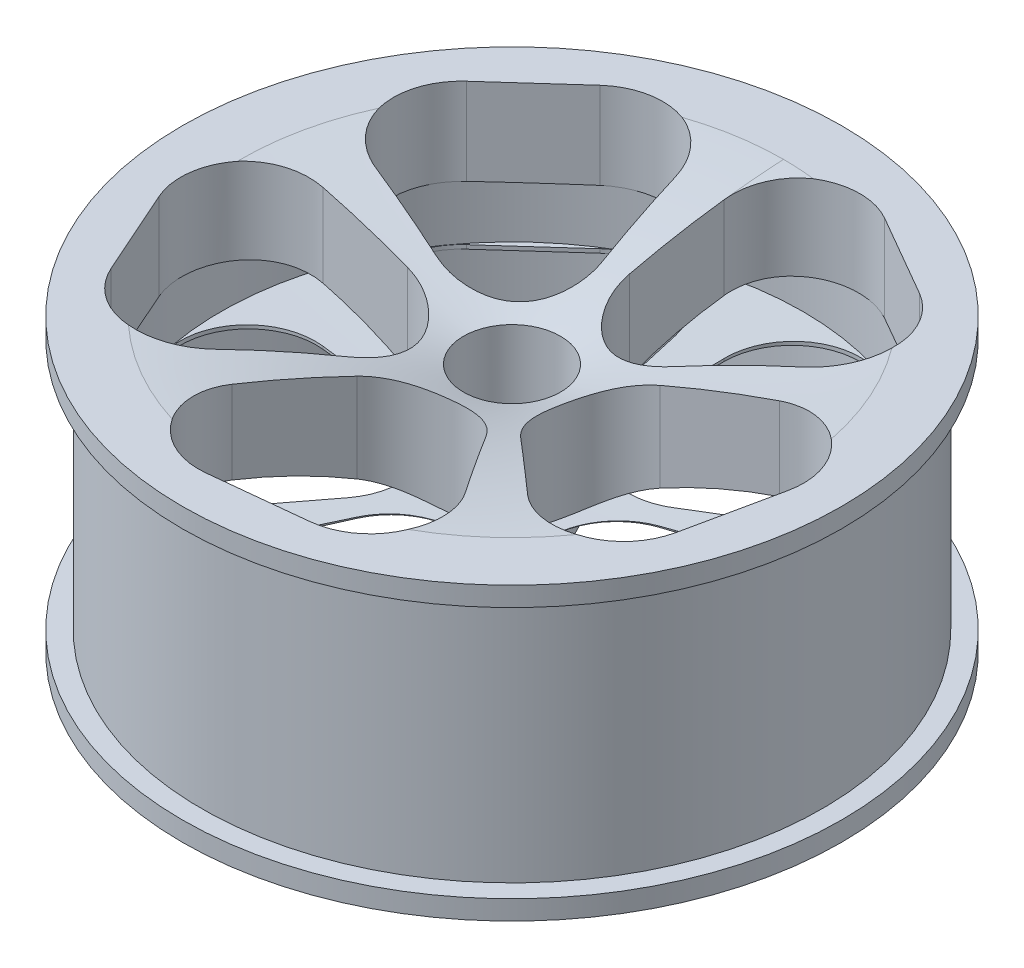
from build123d import *

# Parameters (mm, degrees)
SKETCH1_R           = 50
BOSS_EXTRUDE1_DEPTH = 30
SKETCH3_R           = 340
SKETCH3_R_2         = 50
BOSS_EXTRUDE2_DEPTH = 150
SKETCH5_W           = 20
SKETCH5_H           = 130


with BuildPart() as part:
    # Sketch1 → Boss-Extrude1 (new body)
    with BuildSketch(Plane(origin=(0, 0, 0), x_dir=(1, 0, 0), z_dir=(0, 1, 0))):
        with Locations(Location((0, 0, 0), (0, 0, 270))):
            Circle(SKETCH1_R)
    extrude(amount=BOSS_EXTRUDE1_DEPTH)


with BuildPart() as body_2:
    # Sketch2 → Revolve2 (revolve)
    with BuildSketch(Plane.XY, mode=Mode.PRIVATE) as revolve2_sk:
        Polygon((-300, -27.720873828), (-300, 180), (-340, 180), (-340, 160), (-320, 160), (-320, -100), (-340, -100), (-340, -120), (-300, -120), align=None)
    revolve(revolve2_sk.sketch.rotate(Axis((0, 0, 0), (0, 1, 0)), 270), axis=Axis((0, 0, 0), (0, 1, 0)))

    # Sketch3 → Boss-Extrude2 (add)
    with BuildSketch(Plane(origin=(0, 30, 0), x_dir=(1, 0, 0), z_dir=(0, 1, 0))):
        with Locations(Location((0, 0, 0), (0, 0, 90))):
            Circle(SKETCH3_R)
        with Locations(Location((0, 0, 0), (0, 0, 270))):
            Circle(SKETCH3_R_2, mode=Mode.SUBTRACT)
        with BuildLine():
            Line((105, 60.621778265), (189.448637287, 109.378221735))
            ThreePointArc((189.448637287, 109.378221735), (224.448637287, 170), (189.448637287, 230.621778265))
            Line((189.448637287, 230.621778265), (105, 279.378221735))
            ThreePointArc((105, 279.378221735), (35, 279.378221735), (0, 218.75644347))
            Line((0, 218.75644347), (0, 121.24355653))
            ThreePointArc((0, 121.24355653), (35, 60.621778265), (105, 60.621778265))
        make_face(mode=Mode.SUBTRACT)
        with BuildLine():
            Line((208.049741044, 67.599458661), (115.309474496, 37.466319426))
            ThreePointArc((115.309474496, 37.466319426), (68.470332051, -14.553818357), (90.101521658, -81.127774498))
            Line((90.101521658, -81.127774498), (162.567719005, -146.376631664))
            ThreePointArc((162.567719005, -146.376631664), (231.038051056, -160.930450021), (277.877193501, -108.910312238))
            Line((277.877193501, -108.910312238), (298.151262701, -13.528315837))
            ThreePointArc((298.151262701, -13.528315837), (276.520073095, 53.045640304), (208.049741044, 67.599458661))
        make_face(mode=Mode.SUBTRACT)
        with BuildLine():
            Line((128.581811316, -176.977680396), (71.265174464, -98.088097691))
            ThreePointArc((71.265174464, -98.088097691), (7.316992429, -69.616532676), (-49.314197178, -110.761500336))
            Line((-49.314197178, -110.761500336), (-88.976261468, -199.843955262))
            ThreePointArc((-88.976261468, -199.843955262), (-81.65926904, -269.460487938), (-17.711087005, -297.932052953))
            Line((-17.711087005, -297.932052953), (79.267614138, -287.739180733))
            ThreePointArc((79.267614138, -287.739180733), (135.898803744, -246.594213072), (128.581811316, -176.977680396))
        make_face(mode=Mode.SUBTRACT)
        with BuildLine():
            Line((-128.581811316, -176.977680396), (-71.265174464, -98.088097691))
            ThreePointArc((-71.265174464, -98.088097691), (-63.948182035, -28.471565015), (-120.579371641, 12.673402645))
            Line((-120.579371641, 12.673402645), (-217.558072784, 22.866274866))
            ThreePointArc((-217.558072784, 22.866274866), (-281.506254819, -5.605290149), (-288.823247248, -75.221822825))
            Line((-288.823247248, -75.221822825), (-249.161182957, -164.304277751))
            ThreePointArc((-249.161182957, -164.304277751), (-192.529993351, -205.449245412), (-128.581811316, -176.977680396))
        make_face(mode=Mode.SUBTRACT)
        with BuildLine():
            Line((-208.049741044, 67.599458661), (-115.309474496, 37.466319426))
            ThreePointArc((-115.309474496, 37.466319426), (-46.839142445, 52.020137783), (-25.207952839, 118.594093924))
            Line((-25.207952839, 118.594093924), (-45.482022039, 213.976090325))
            ThreePointArc((-45.482022039, 213.976090325), (-92.321164484, 265.996228109), (-160.791496536, 251.442409752))
            Line((-160.791496536, 251.442409752), (-233.257693883, 186.193552585))
            ThreePointArc((-233.257693883, 186.193552585), (-254.888883489, 119.619596445), (-208.049741044, 67.599458661))
        make_face(mode=Mode.SUBTRACT)
    extrude(amount=BOSS_EXTRUDE2_DEPTH)

    # Sketch4 → Cut-Revolve1 (revolve, cut)
    with BuildSketch(Plane.XY, mode=Mode.PRIVATE) as cut_revolve1_sk:
        with BuildLine():
            Line((-300, 216.27795399), (-300, 180.885417192))
            ThreePointArc((-300, 180.885417192), (-173.357132809, 167.752599493), (-49.811718455, 136.97245487))
            Line((-49.811718455, 136.97245487), (0, 136.97245487))
            Line((0, 136.97245487), (0, 173.675826363))
            Line((0, 173.675826363), (0, 216.27795399))
            Line((0, 216.27795399), (-300, 216.27795399))
        make_face()
        with BuildLine():
            Line((-300, 83.228232326), (-300, 79.295728237))
            Line((-300, 79.295728237), (-300, 34.071931218))
            Line((-300, 34.071931218), (-49.811718455, 30))
            ThreePointArc((-49.811718455, 30), (-170.062054213, 80.270316304), (-300, 90.437823155))
            Line((-300, 90.437823155), (-300, 83.228232326))
        make_face()
    revolve(cut_revolve1_sk.sketch.rotate(Axis((0, 173.675826363, 0), (0, -1, 0)), 90), axis=Axis((0, 173.675826363, 0), (0, -1, 0)), mode=Mode.SUBTRACT)

    # Sketch5 → Cut-Revolve2 (revolve, cut)
    with BuildSketch(Plane(origin=(0, 0, 0), x_dir=(0, 0, -1), z_dir=(1, 0, 0)), mode=Mode.PRIVATE) as cut_revolve2_sk:
        with Locations((-330, 95)):
            Rectangle(SKETCH5_W, SKETCH5_H)
    revolve(cut_revolve2_sk.sketch.rotate(Axis((0, -21.428252006, 0), (0, 1, 0)), 180), axis=Axis((0, -21.428252006, 0), (0, 1, 0)), mode=Mode.SUBTRACT)


solid = Compound([part.part, body_2.part])
